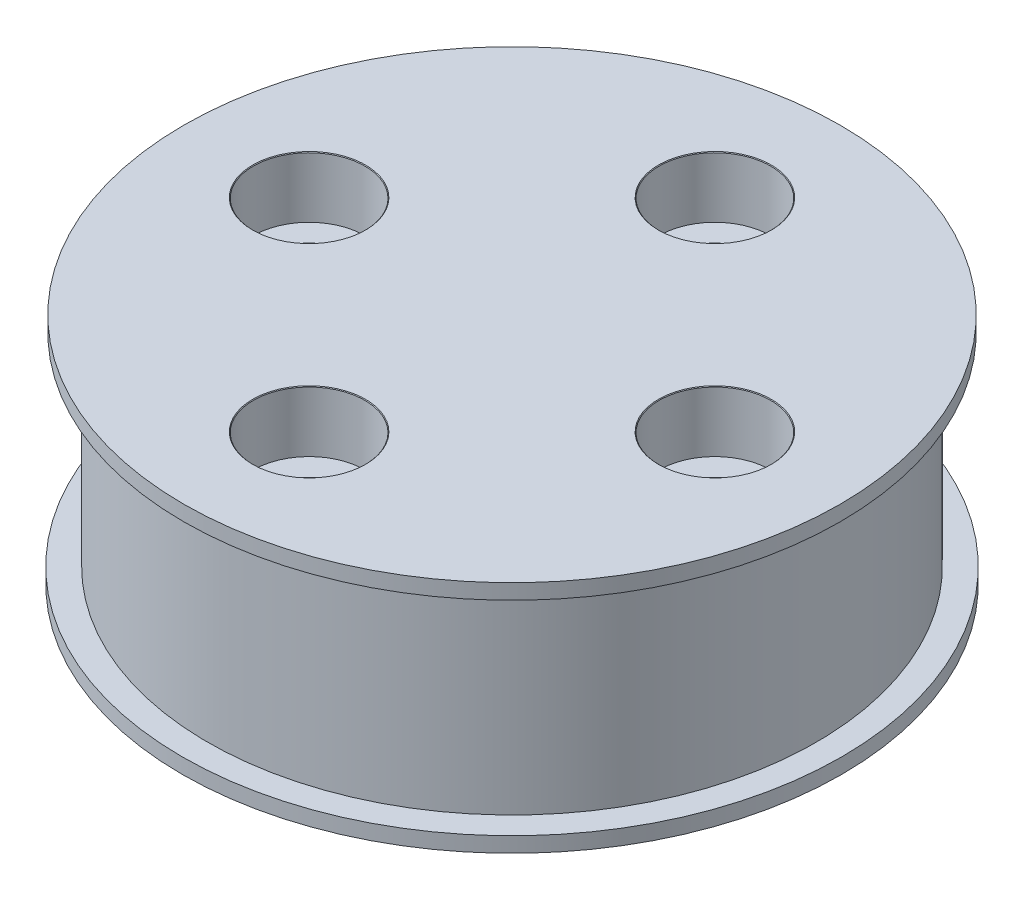
from build123d import *

# Parameters (mm, degrees)
CBORE_FOR_M2_HEX_SOCKET_HEAD_CAP_SCR_2_COUNT = 2
CBORE_FOR_M2_HEX_SOCKET_HEAD_CAP_SCR_2_PITCH = 11.313708499
CBORE_FOR_M2_HEX_SOCKET_HEAD_CAP_SCR_3_COUNT = 2
CBORE_FOR_M2_HEX_SOCKET_HEAD_CAP_SCR_3_PITCH = 16
CBORE_FOR_M2_HEX_SOCKET_HEAD_CAP_SCR_4_COUNT = 2
CBORE_FOR_M2_HEX_SOCKET_HEAD_CAP_SCR_4_PITCH = 11.313708499
SKETCH6_R                                    = 4
CUT_EXTRUDE1_DEPTH                           = 2.5


with BuildPart() as part:
    # Sketch1 → Revolve1 (revolve)
    with BuildSketch(Plane.XY, mode=Mode.PRIVATE) as revolve1_sk:
        Polygon((0, 0), (13, 0), (13, 0.6), (12, 0.6), (12, 8.6), (12.942857143, 8.6), (12.942857143, 9.2), (0, 9.2), align=None)
    revolve(revolve1_sk.sketch.rotate(Axis((0, 9.2, 0), (0, -1, 0)), 180), axis=Axis((0, 9.2, 0), (0, -1, 0)))

    # Sketch3 → CBORE for M2 Hex Socket Head Cap Screw1 (revolve, cut)
    with BuildSketch(Plane(origin=(-8, 9.2, 0), x_dir=(0, 0, 1), z_dir=(1, 0, 0))):
        Polygon((0, 0), (0, 9.2), (1.2, 9.2), (1.2, 2.4), (2.2, 2.4), (2.2, 0.025), (2.225, 0), align=None)
    cbore_for_m2_hex_socket_head_cap_screw1 = revolve(axis=Axis((-8, 15.55, 0), (0, -1, 0)), mode=Mode.SUBTRACT)

    # CBORE for M2 Hex Socket Head Cap Scr 2: CBORE for M2 Hex Socket Head Cap Screw1 ×2
    with Locations(*[Vector(0.7071067811865277, 0, -0.7071067811865673) * (i * CBORE_FOR_M2_HEX_SOCKET_HEAD_CAP_SCR_2_PITCH) for i in range(1, CBORE_FOR_M2_HEX_SOCKET_HEAD_CAP_SCR_2_COUNT)]):
        add(cbore_for_m2_hex_socket_head_cap_screw1, mode=Mode.SUBTRACT)

    # CBORE for M2 Hex Socket Head Cap Scr 3: CBORE for M2 Hex Socket Head Cap Screw1 ×2
    with Locations(*[(i * CBORE_FOR_M2_HEX_SOCKET_HEAD_CAP_SCR_3_PITCH, 0, 0) for i in range(1, CBORE_FOR_M2_HEX_SOCKET_HEAD_CAP_SCR_3_COUNT)]):
        add(cbore_for_m2_hex_socket_head_cap_screw1, mode=Mode.SUBTRACT)

    # CBORE for M2 Hex Socket Head Cap Scr 4: CBORE for M2 Hex Socket Head Cap Screw1 ×2
    with Locations(*[Vector(0.7071067811865674, 0, 0.7071067811865276) * (i * CBORE_FOR_M2_HEX_SOCKET_HEAD_CAP_SCR_4_PITCH) for i in range(1, CBORE_FOR_M2_HEX_SOCKET_HEAD_CAP_SCR_4_COUNT)]):
        add(cbore_for_m2_hex_socket_head_cap_screw1, mode=Mode.SUBTRACT)

    # Sketch6 → Cut-Extrude1 (cut)
    with BuildSketch(Plane.XZ):
        with Locations(Location((0, 0, 0), (0, 0, 270))):
            Circle(SKETCH6_R)
    extrude(amount=-CUT_EXTRUDE1_DEPTH, mode=Mode.SUBTRACT)


solid = part.part
